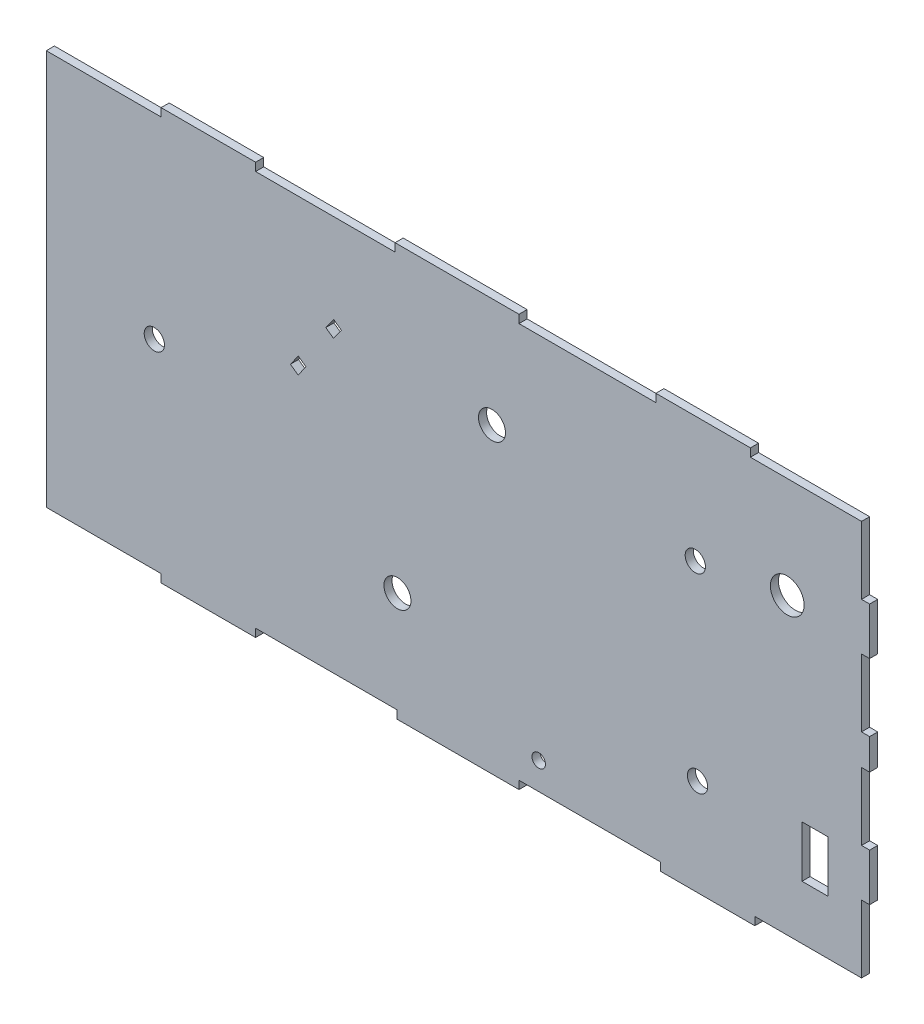
from build123d import *

# Parameters (mm, degrees)
SKETCH1_R           = 7.5
SKETCH1_R_2         = 5
SKETCH1_R_3         = 10
SKETCH1_R_4         = 12.5
SKETCH1_W           = 38.1
SKETCH1_H           = 19.05
BOSS_EXTRUDE2_DEPTH = 6


with BuildPart() as part:
    # Sketch1 → Boss-Extrude2 (new body)
    with BuildSketch(Plane(origin=(0, 0, 0), x_dir=(0, 1, 0), z_dir=(0, 0, 1))):
        Polygon((302.864595387, -433.000855558), (352.864595387, -433.000855558), (352.864595387, -439.000855558), (387.864595387, -439.000855558), (387.864595387, -433.000855558), (437.864595387, -433.000855558), (437.864595387, -439.000855558), (460.664595387, -439.000855558), (460.664595387, -433.000855558), (510.664595387, -433.000855558), (510.664595387, -439.000855558), (545.664595387, -439.000855558), (545.664595387, -433.000855558), (595.664595387, -433.000855558), (595.664595387, -350.737424545), (601.664595387, -350.737424545), (601.664595387, -280.737424545), (595.664595387, -280.737424545), (595.664595387, -179.400855558), (601.664595387, -179.400855558), (601.664595387, -87.636640664), (595.664595387, -87.636640664), (595.664595387, 15.599144442), (601.664595387, 15.599144442), (601.664595387, 85.599144442), (595.664595387, 85.599144442), (595.664595387, 100.599144442), (595.664595387, 170.599144442), (525.664595387, 170.599144442), (372.864595387, 170.599144442), (302.864595387, 170.599144442), (302.864595387, 100.599144442), (302.864595387, 85.599144442), (296.864595387, 85.599144442), (296.864595387, 15.599144442), (302.864595387, 15.599144442), (302.864595387, -89.000855558), (296.864595387, -89.000855558), (296.864595387, -179.400855558), (302.864595387, -179.400855558), (302.864595387, -284.000855558), (296.864595387, -284.000855558), (296.864595387, -354.000855558), (302.864595387, -354.000855558), align=None)
        with Locations(Location((450.664595387, 90.599144442, 0), (0, 0, 270))):
            Circle(SKETCH1_R, mode=Mode.SUBTRACT)
        with Locations(Location((322.864595387, -194.000855558, 0), (0, 0, 270))):
            Circle(SKETCH1_R_2, mode=Mode.SUBTRACT)
        with Locations(Location((508.701533875, -309.936805208, 0), (0, 0, 270))):
            Circle(SKETCH1_R, mode=Mode.SUBTRACT)
        with Locations(Location((368.382345964, -311.573747263, 0), (0, 0, 90))):
            Circle(SKETCH1_R, mode=Mode.SUBTRACT)
        with Locations(Location((377.864595387, -89.400855558, 0), (0, 0, 270))):
            Circle(SKETCH1_R_3, mode=Mode.SUBTRACT)
        with Locations(Location((520.664595387, -159.400855558, 0), (0, 0, 270))):
            Circle(SKETCH1_R_3, mode=Mode.SUBTRACT)
        with Locations(Location((520.664595387, -378.000855558, 0), (0, 0, 270))):
            Circle(SKETCH1_R_4, mode=Mode.SUBTRACT)
        Polygon((480.935500713, -15.863437319), (489.068063381, -21.682494326), (493.141403286, -15.989700458), (485.008840618, -10.170643451), align=None, mode=Mode.SUBTRACT)
        Polygon((525.664595387, -47.868250858), (529.737935292, -42.17545699), (521.605372624, -36.356399983), (517.532032719, -42.04919385), align=None, mode=Mode.SUBTRACT)
        with Locations((361.914595387, -398.475855558)):
            Rectangle(SKETCH1_W, SKETCH1_H, mode=Mode.SUBTRACT)
    extrude(amount=BOSS_EXTRUDE2_DEPTH)


solid = part.part
